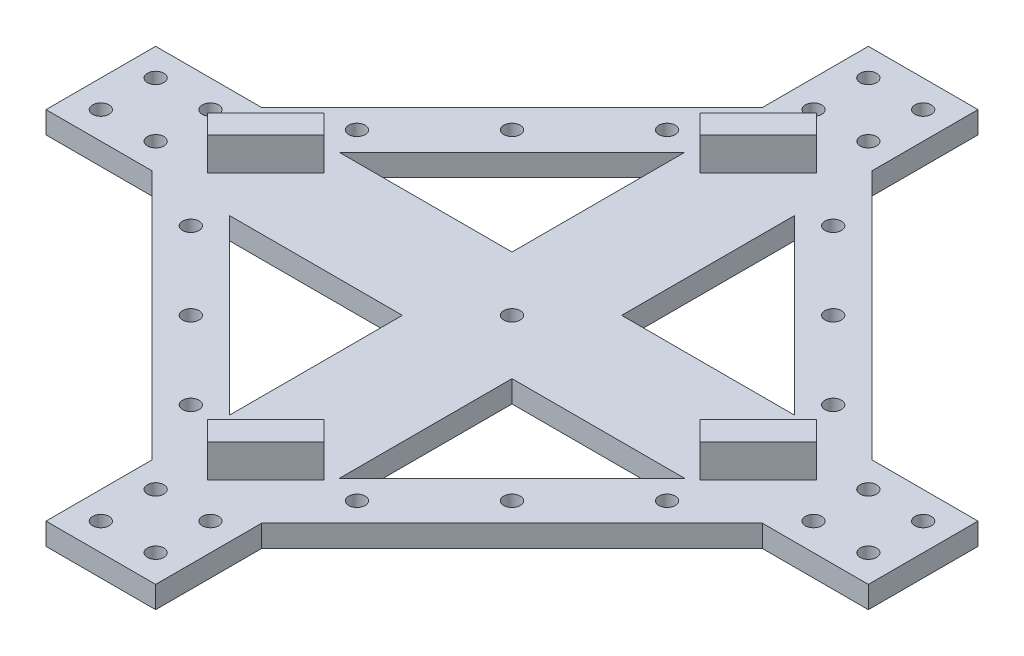
from build123d import *

# Parameters (mm, degrees)
SKETCH1_R             = 1.5
BASE_DEPTH            = 4
BATTERYCLIP_DEPTH     = 6
F_3_0MM_DOWEL_HOLE2_D = 3
CIRPATTERN2_COUNT     = 4


with BuildPart() as part:
    # Sketch1 → Base (new body)
    with BuildSketch(Plane(origin=(0, 0, 0), x_dir=(1, 0, 0), z_dir=(0, 1, 0))):
        Polygon((85, 85), (65.656854249, 85), (20, 130.656854249), (20, 150), (0, 150), (0, 130.656854249), (-45.656854249, 85), (-65, 85), (-65, 65), (-45.656854249, 65), (0, 19.343145751), (0, 0), (20, 0), (20, 19.343145751), (65.656854249, 65), (85, 65), align=None)
        Polygon((51.514718626, 85), (20, 85), (20, 116.514718626), align=None, mode=Mode.SUBTRACT)
        Polygon((20, 65), (51.514718626, 65), (20, 33.485281374), align=None, mode=Mode.SUBTRACT)
        Polygon((0, 65), (0, 33.485281374), (-31.514718626, 65), align=None, mode=Mode.SUBTRACT)
        Polygon((0, 85), (-31.514718626, 85), (0, 116.514718626), align=None, mode=Mode.SUBTRACT)
        with Locations((10, 75)):
            Circle(SKETCH1_R, mode=Mode.SUBTRACT)
    extrude(amount=BASE_DEPTH)

    # Sketch2 → BatteryClip (add)
    with BuildSketch(Plane(origin=(0, 4, 0), x_dir=(1, 0, 0), z_dir=(0, 1, 0))):
        Polygon((15.303300859, 35.402020254), (4.696699141, 24.795418536), (8.232233047, 21.25988463), (18.838834765, 31.866486348), align=None)
        Polygon((11.767766953, 128.74011537), (1.161165235, 118.133513652), (4.696699141, 114.597979746), (15.303300859, 125.204581464), align=None)
        Polygon((49.597979746, 69.696699141), (60.204581464, 80.303300859), (63.74011537, 76.767766953), (53.133513652, 66.161165235), align=None)
        Polygon((-43.74011537, 73.232233047), (-33.133513652, 83.838834765), (-29.597979746, 80.303300859), (-40.204581464, 69.696699141), align=None)
    extrude(amount=BATTERYCLIP_DEPTH)

    # Ø3.0mm Dowel Hole2 (through all)
    with Locations(Plane(origin=(5, 4, -5), x_dir=(0, 0, 1), z_dir=(0, 1, 0))):
        with Locations((0, 0), (-10, 0), (-10, 10), (0, 10), (-26.564971157, -10.150757595), (-40.707106781, -24.292893219), (-54.849242405, -38.435028843)):
            f_3_0mm_dowel_hole2 = Hole(F_3_0MM_DOWEL_HOLE2_D / 2)

    # CirPattern2: Ø3.0mm Dowel Hole2 ×4 about axis
    cirpattern2_axis = Axis((10, 4, -75), (0, -1, 0))
    for i in range(1, CIRPATTERN2_COUNT):
        add(f_3_0mm_dowel_hole2.rotate(cirpattern2_axis, i * 360 / CIRPATTERN2_COUNT), mode=Mode.SUBTRACT)


solid = part.part
